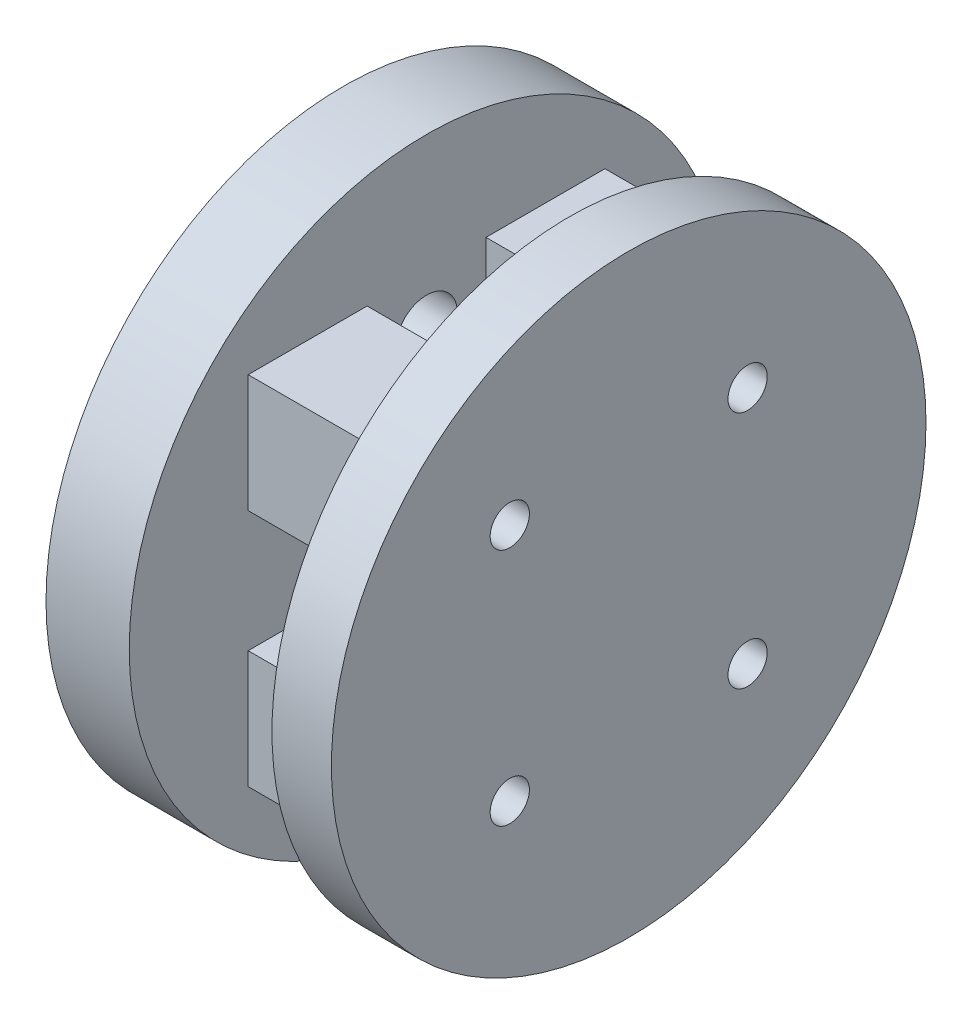
from build123d import *

# Parameters (mm, degrees)
SKETCH1_W           = 30
SKETCH1_H           = 30
BOSS_EXTRUDE1_DEPTH = 7
SKETCH2_W           = 10
SKETCH2_H           = 9.9
BOSS_EXTRUDE2_DEPTH = 12
SKETCH3_R           = 2.596307875
CUT_EXTRUDE1_DEPTH  = 25.372115214
SKETCH4_R           = 25
SKETCH4_W           = 30
SKETCH4_H           = 30
BOSS_EXTRUDE4_DEPTH = 7
SKETCH5_R           = 25
BOSS_EXTRUDE5_DEPTH = 5
SKETCH6_R           = 1.45
CUT_EXTRUDE2_DEPTH  = 10
SKETCH7_R           = 1.65
CUT_EXTRUDE3_DEPTH  = 43.731721238


with BuildPart() as part:
    # Sketch1 → Boss-Extrude1 (new body)
    with BuildSketch(Plane(origin=(0, 0, 0), x_dir=(0, 0, -1), z_dir=(1, 0, 0))):
        Rectangle(SKETCH1_W, SKETCH1_H)
    extrude(amount=BOSS_EXTRUDE1_DEPTH)

    # Sketch2 → Boss-Extrude2 (add)
    with BuildSketch(Plane(origin=(7, 0, 0), x_dir=(0, 0, -1), z_dir=(1, 0, 0))):
        with Locations((-10, 10.05)):
            Rectangle(SKETCH2_W, SKETCH2_H)
        with Locations((10, 10.05)):
            Rectangle(SKETCH2_W, SKETCH2_H)
        with Locations((10, -10.05)):
            Rectangle(SKETCH2_W, SKETCH2_H)
        with Locations((-10, -10.05)):
            Rectangle(SKETCH2_W, SKETCH2_H)
    extrude(amount=BOSS_EXTRUDE2_DEPTH)

    # Sketch3 → Cut-Extrude1 (cut, through all)
    with BuildSketch(Plane(origin=(7, 0, 0), x_dir=(0, 0, -1), z_dir=(1, 0, 0))):
        with Locations((0, 10.7)):
            Circle(SKETCH3_R)
        with Locations((0, -10.7)):
            Circle(SKETCH3_R)
        Circle(SKETCH3_R)
    extrude(amount=-CUT_EXTRUDE1_DEPTH, mode=Mode.SUBTRACT)

    # Sketch4 → Boss-Extrude4 (add)
    with BuildSketch(Plane.ZY):
        Circle(SKETCH4_R)
        Rectangle(SKETCH4_W, SKETCH4_H, mode=Mode.SUBTRACT)
    extrude(amount=-BOSS_EXTRUDE4_DEPTH)


with BuildPart() as body_2:
    # Sketch5 → Boss-Extrude5 (new body)
    with BuildSketch(Plane(origin=(19, 0, 0), x_dir=(0, 0, -1), z_dir=(1, 0, 0))):
        Circle(SKETCH5_R)
    extrude(amount=BOSS_EXTRUDE5_DEPTH)


with BuildPart() as cut_extrude2_tool:
    # Sketch6 → Cut-Extrude2 (new body)
    with BuildSketch(Plane(origin=(24, 0, 0), x_dir=(0, 0, -1), z_dir=(1, 0, 0))):
        with Locations((-10, 10.05)):
            Circle(SKETCH6_R)
        with Locations((-10, -10.05)):
            Circle(SKETCH6_R)
        with Locations((10, -10.05)):
            Circle(SKETCH6_R)
        with Locations((10, 10.05)):
            Circle(SKETCH6_R)
    extrude(amount=-CUT_EXTRUDE2_DEPTH)


with BuildPart() as part_1:
    add(part.part)

    # Cut-Extrude2: cut by cut_extrude2_tool
    add(cut_extrude2_tool.part, mode=Mode.SUBTRACT)


with BuildPart() as body_2_1:
    add(body_2.part)

    # Cut-Extrude2: cut by cut_extrude2_tool
    add(cut_extrude2_tool.part, mode=Mode.SUBTRACT)

    # Sketch7 → Cut-Extrude3 (cut, through all)
    with BuildSketch(Plane(origin=(24, 0, 0), x_dir=(0, 0, -1), z_dir=(1, 0, 0))):
        with Locations((-10, 10.05)):
            Circle(SKETCH7_R)
        with Locations((-10, -10.05)):
            Circle(SKETCH7_R)
        with Locations((10, -10.05)):
            Circle(SKETCH7_R)
        with Locations((10, 10.05)):
            Circle(SKETCH7_R)
    extrude(amount=-CUT_EXTRUDE3_DEPTH, mode=Mode.SUBTRACT)


solid = Compound([part_1.part, body_2_1.part])
